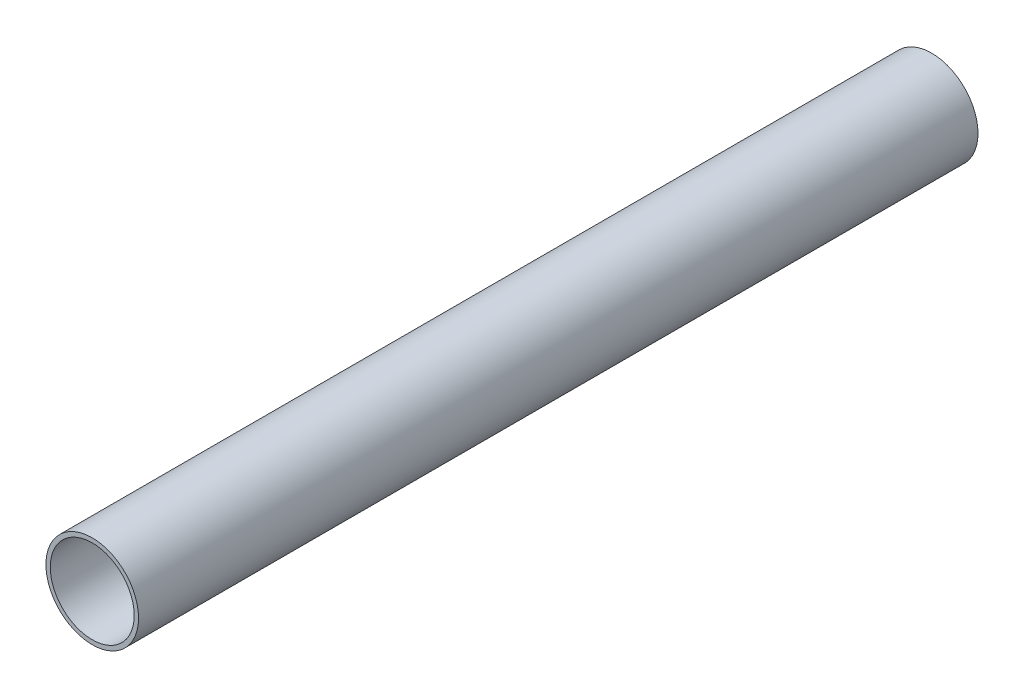
from build123d import *

# Parameters (mm, degrees)
SKETCH1_W = 145
SKETCH1_H = 0.75


with BuildPart() as part:
    # Sketch1 → Revolve1 (revolve)
    with BuildSketch(Plane(origin=(0, 0, 0), x_dir=(0, 0, -1), z_dir=(1, 0, 0)), mode=Mode.PRIVATE) as revolve1_sk:
        with Locations((0, 7.625)):
            Rectangle(SKETCH1_W, SKETCH1_H)
    revolve(revolve1_sk.sketch.rotate(Axis((0, 0, 72.5), (0, 0, -1)), 90), axis=Axis((0, 0, 72.5), (0, 0, -1)))


solid = part.part
